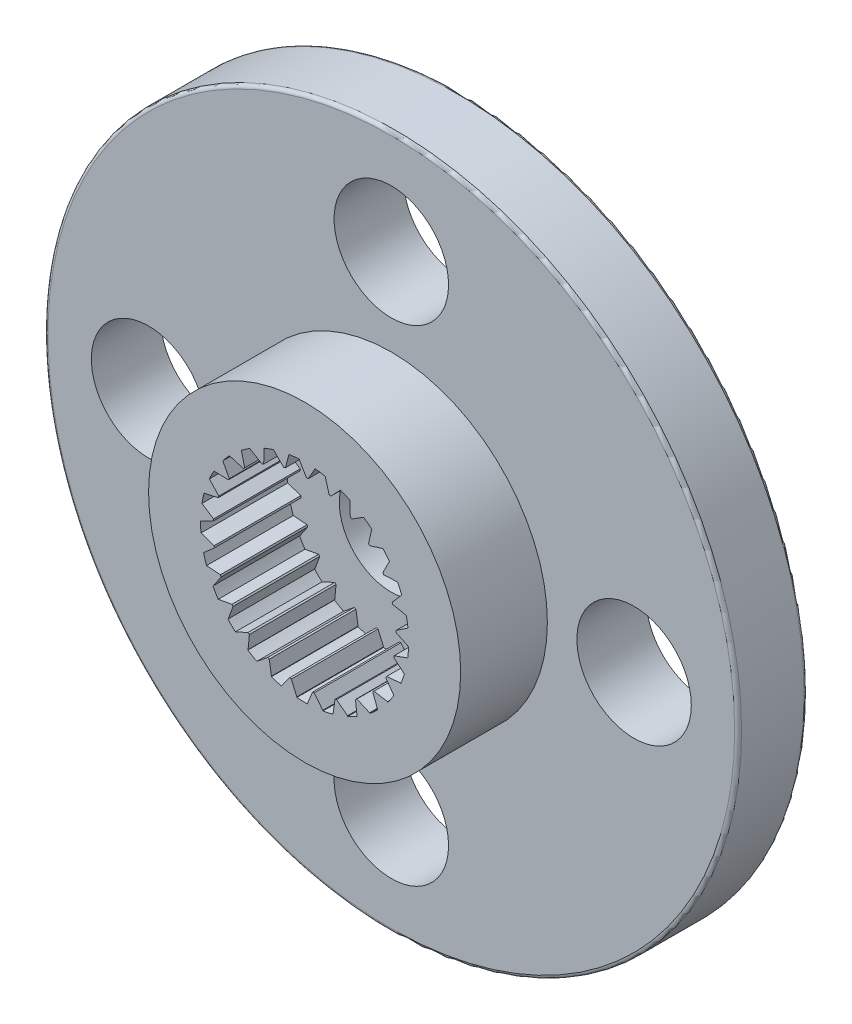
from build123d import *

# Parameters (mm, degrees)
SKETCH3_R           = 10
SKETCH3_R_2         = 1.5
BOSS_EXTRUDE2_DEPTH = 2
FILLET1_R           = 0.1
SKETCH5_R           = 4.5
SKETCH5_R_2         = 3
BOSS_EXTRUDE3_DEPTH = 2.5
SKETCH6_R           = 4.5
SKETCH6_R_2         = 3.5
CUT_EXTRUDE3_DEPTH  = 0.3
BOSS_EXTRUDE1_DEPTH = 4.5
CIRPATTERN6_COUNT   = 25
CUT_EXTRUDE4_REACH  = 16.361
SKETCH8_R           = 1.65


with BuildPart() as part:
    # Sketch3 → Boss-Extrude2 (new body)
    with BuildSketch(Plane.XY):
        Circle(SKETCH3_R)
        Circle(SKETCH3_R_2, mode=Mode.SUBTRACT)
    extrude(amount=BOSS_EXTRUDE2_DEPTH)

    # Fillet1
    fillet1_edges = [part.edges().sort_by_distance(p)[0] for p in [
        (-10, 0, 0),
        (-10, 0, 2),
    ]]
    fillet(fillet1_edges, radius=FILLET1_R)

    # Sketch5 → Boss-Extrude3 (add)
    with BuildSketch(Plane.XY.offset(2)):
        Circle(SKETCH5_R)
        Circle(SKETCH5_R_2, mode=Mode.SUBTRACT)
    extrude(amount=BOSS_EXTRUDE3_DEPTH)

    # Sketch6 → Cut-Extrude3 (cut)
    with BuildSketch(Plane(origin=(0, 0, 0), x_dir=(-1, 0, 0), z_dir=(0, 0, -1))):
        with Locations(Location((0, 0, 0), (0, 0, 180))):
            Circle(SKETCH6_R)
        Circle(SKETCH6_R_2, mode=Mode.SUBTRACT)
    extrude(amount=-CUT_EXTRUDE3_DEPTH, mode=Mode.SUBTRACT)

    # Sketch2 → Boss-Extrude1 (add)
    with BuildSketch(Plane.XY):
        Polygon((-0.224920346, -2.97556486), (-0.224920346, -3.054661592), (-0.671931157, -3.032807749), (-0.671931157, -2.923783255), (-0.433398187, -2.602688219), (-0.383730319, -2.608441731), align=None)
    boss_extrude1 = extrude(amount=BOSS_EXTRUDE1_DEPTH)

    # CirPattern6: Boss-Extrude1 ×25 about axis
    cirpattern6_axis = Axis((0, 0, 0), (0, 0, 1))
    for i in range(1, CIRPATTERN6_COUNT):
        add(boss_extrude1.rotate(cirpattern6_axis, i * 360 / CIRPATTERN6_COUNT))

    # Sketch8 → Cut-Extrude4 (cut, up to next)
    with BuildSketch(Plane.XY.offset(2), mode=Mode.PRIVATE) as cut_extrude4_sk1:
        with Locations((0, 7)):
            Circle(SKETCH8_R)
    cut_extrude4_tool1 = extrude(cut_extrude4_sk1.sketch, amount=-CUT_EXTRUDE4_REACH, mode=Mode.PRIVATE) & part.part
    # Sketch8 → Cut-Extrude4 (cut, up to next)
    with BuildSketch(Plane.XY.offset(2), mode=Mode.PRIVATE) as cut_extrude4_sk2:
        with Locations((0, -7)):
            Circle(SKETCH8_R)
    cut_extrude4_tool2 = extrude(cut_extrude4_sk2.sketch, amount=-CUT_EXTRUDE4_REACH, mode=Mode.PRIVATE) & part.part
    # Sketch8 → Cut-Extrude4 (cut, up to next)
    with BuildSketch(Plane.XY.offset(2), mode=Mode.PRIVATE) as cut_extrude4_sk3:
        with Locations((7, 0)):
            Circle(SKETCH8_R)
    cut_extrude4_tool3 = extrude(cut_extrude4_sk3.sketch, amount=-CUT_EXTRUDE4_REACH, mode=Mode.PRIVATE) & part.part
    # Sketch8 → Cut-Extrude4 (cut, up to next)
    with BuildSketch(Plane.XY.offset(2), mode=Mode.PRIVATE) as cut_extrude4_sk4:
        with Locations((-7, 0)):
            Circle(SKETCH8_R)
    cut_extrude4_tool4 = extrude(cut_extrude4_sk4.sketch, amount=-CUT_EXTRUDE4_REACH, mode=Mode.PRIVATE) & part.part
    add(cut_extrude4_tool1.solids().sort_by_distance((0, 7, 2))[0], mode=Mode.SUBTRACT)
    add(cut_extrude4_tool2.solids().sort_by_distance((0, -7, 2))[0], mode=Mode.SUBTRACT)
    add(cut_extrude4_tool3.solids().sort_by_distance((7, 0, 2))[0], mode=Mode.SUBTRACT)
    add(cut_extrude4_tool4.solids().sort_by_distance((-7, 0, 2))[0], mode=Mode.SUBTRACT)


solid = part.part
